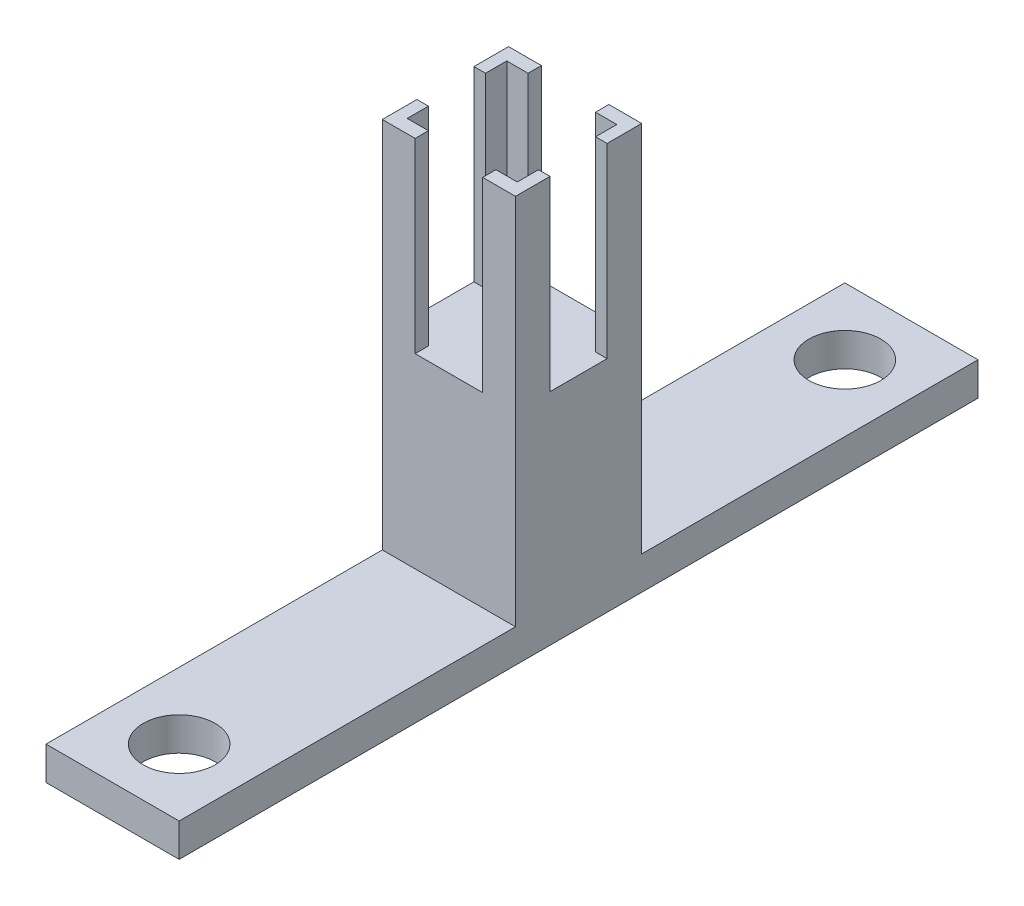
from build123d import *

# Parameters (mm, degrees)
BOSS_EXTRUDE1_DEPTH   = 17.78
BOSS_EXTRUDE1_2_DEPTH = 17.78
BOSS_EXTRUDE1_3_DEPTH = 17.78
BOSS_EXTRUDE1_4_DEPTH = 17.78
SKETCH2_W             = 13.04
SKETCH2_H             = 12.04
BOSS_EXTRUDE2_DEPTH   = 17.78
SKETCH3_W             = 12.7
SKETCH3_H             = 76.2
SKETCH3_R             = 3.429
BOSS_EXTRUDE3_DEPTH   = 3.175
SKETCH4_OUTSIDE_W     = 32.334
SKETCH4_OUTSIDE_H     = 95.494
SKETCH4_OUTSIDE_W_2   = 12.7
SKETCH4_OUTSIDE_H_2   = 76.2
CUT_EXTRUDE2_DEPTH    = 55.722213268


with BuildPart() as part:
    # Sketch1 → Boss-Extrude1 (new body)
    with BuildSketch(Plane(origin=(0, 0, 0), x_dir=(1, 0, 0), z_dir=(0, 1, 0))):
        Polygon((-5.25, 4.75), (-5.25, 2.718), (-6.52, 2.718), (-6.52, 6.02), (-3.218, 6.02), (-3.218, 4.75), align=None)
    extrude(amount=BOSS_EXTRUDE1_DEPTH)



with BuildPart() as body_2:
    # Sketch1 → Boss-Extrude1 2 (new body)
    with BuildSketch(Plane(origin=(0, 0, 0), x_dir=(1, 0, 0), z_dir=(0, 1, 0))):
        Polygon((6.52, 2.718), (6.52, 6.02), (3.218, 6.02), (3.218, 4.75), (5.25, 4.75), (5.25, 2.718), align=None)
    extrude(amount=BOSS_EXTRUDE1_2_DEPTH)


with BuildPart() as body_3:
    # Sketch1 → Boss-Extrude1 3 (new body)
    with BuildSketch(Plane(origin=(0, 0, 0), x_dir=(1, 0, 0), z_dir=(0, 1, 0))):
        Polygon((5.25, -2.718), (6.52, -2.718), (6.52, -6.02), (3.218, -6.02), (3.218, -4.75), (5.25, -4.75), align=None)
    extrude(amount=BOSS_EXTRUDE1_3_DEPTH)


with BuildPart() as body_4:
    # Sketch1 → Boss-Extrude1 4 (new body)
    with BuildSketch(Plane(origin=(0, 0, 0), x_dir=(1, 0, 0), z_dir=(0, 1, 0))):
        Polygon((-5.25, -2.718), (-6.52, -2.718), (-6.52, -6.02), (-3.218, -6.02), (-3.218, -4.75), (-5.25, -4.75), align=None)
    extrude(amount=BOSS_EXTRUDE1_4_DEPTH)


with BuildPart() as part_1:
    add(part.part)

    add(body_2.part)  # Boss-Extrude2 merges body 2

    add(body_3.part)  # Boss-Extrude2 merges body 3

    add(body_4.part)  # Boss-Extrude2 merges body 4
    # Sketch2 → Boss-Extrude2 (add)
    with BuildSketch(Plane(origin=(0, 0, 0), x_dir=(-1, 0, 0), z_dir=(0, -1, 0))):
        Rectangle(SKETCH2_W, SKETCH2_H)
    extrude(amount=BOSS_EXTRUDE2_DEPTH)

    # Sketch3 → Boss-Extrude3 (add)
    with BuildSketch(Plane(origin=(0, -17.78, 0), x_dir=(-1, 0, 0), z_dir=(0, -1, 0))):
        Rectangle(SKETCH3_W, SKETCH3_H)
        with Locations(Location((0, 31.75, 0), (0, 0, 90))):
            Circle(SKETCH3_R, mode=Mode.SUBTRACT)
        with Locations(Location((0, -31.75, 0), (0, 0, 270))):
            Circle(SKETCH3_R, mode=Mode.SUBTRACT)
    extrude(amount=BOSS_EXTRUDE3_DEPTH)

    # Sketch4 outside → Cut-Extrude2 (cut, through all)
    with BuildSketch(Plane.XZ.offset(20.955)):
        Rectangle(SKETCH4_OUTSIDE_W, SKETCH4_OUTSIDE_H)
        Rectangle(SKETCH4_OUTSIDE_W_2, SKETCH4_OUTSIDE_H_2, mode=Mode.SUBTRACT)
    extrude(amount=-CUT_EXTRUDE2_DEPTH, mode=Mode.SUBTRACT)


solid = part_1.part
